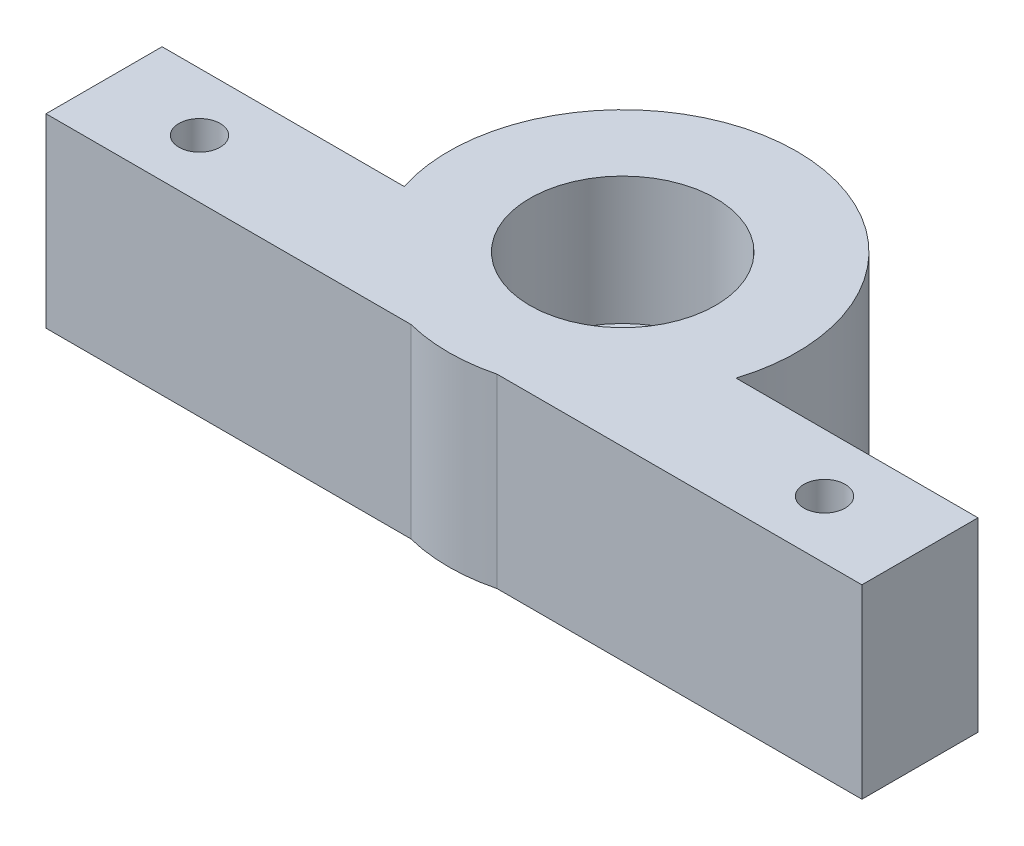
from build123d import *

# Parameters (mm, degrees)
SKETCH1_R           = 1.875
SKETCH1_R_2         = 0.889
BOSS_EXTRUDE1_DEPTH = 8
SKETCH2_R           = 4
CUT_EXTRUDE1_DEPTH  = 5.5


with BuildPart() as part:
    # Sketch1 → Boss-Extrude1 (new body)
    with BuildSketch(Plane(origin=(0, 0, 0), x_dir=(1, 0, 0), z_dir=(0, 1, 0))):
        with BuildLine():
            Line((-7.148944203, -2.267729434), (-17.572518578, -2.267729434))
            Line((-17.572518578, -2.267729434), (-17.572518578, -7.267729434))
            Line((-17.572518578, -7.267729434), (-1.852055311, -7.267729434))
            ThreePointArc((-1.852055311, -7.267729434), (0, -7.5), (1.852055311, -7.267729434))
            Line((1.852055311, -7.267729434), (17.569617046, -7.267729434))
            Line((17.569617046, -7.267729434), (17.569617046, -2.267729434))
            Line((17.569617046, -2.267729434), (7.148944203, -2.267729434))
            ThreePointArc((7.148944203, -2.267729434), (0, 7.5), (-7.148944203, -2.267729434))
        make_face()
        with Locations(Location((0, 0, 0), (0, 0, 270))):
            Circle(SKETCH1_R, mode=Mode.SUBTRACT)
        with Locations(Location((-13.46, -4.767729434, 0), (0, 0, 270))):
            Circle(SKETCH1_R_2, mode=Mode.SUBTRACT)
        with Locations(Location((13.46, -4.767729434, 0), (0, 0, 270))):
            Circle(SKETCH1_R_2, mode=Mode.SUBTRACT)
    extrude(amount=BOSS_EXTRUDE1_DEPTH)

    # Sketch2 → Cut-Extrude1 (cut)
    with BuildSketch(Plane(origin=(0, 8, 0), x_dir=(1, 0, 0), z_dir=(0, 1, 0))):
        with Locations(Location((0, 0, 0), (0, 0, 270))):
            Circle(SKETCH2_R)
    extrude(amount=-CUT_EXTRUDE1_DEPTH, mode=Mode.SUBTRACT)


solid = part.part
